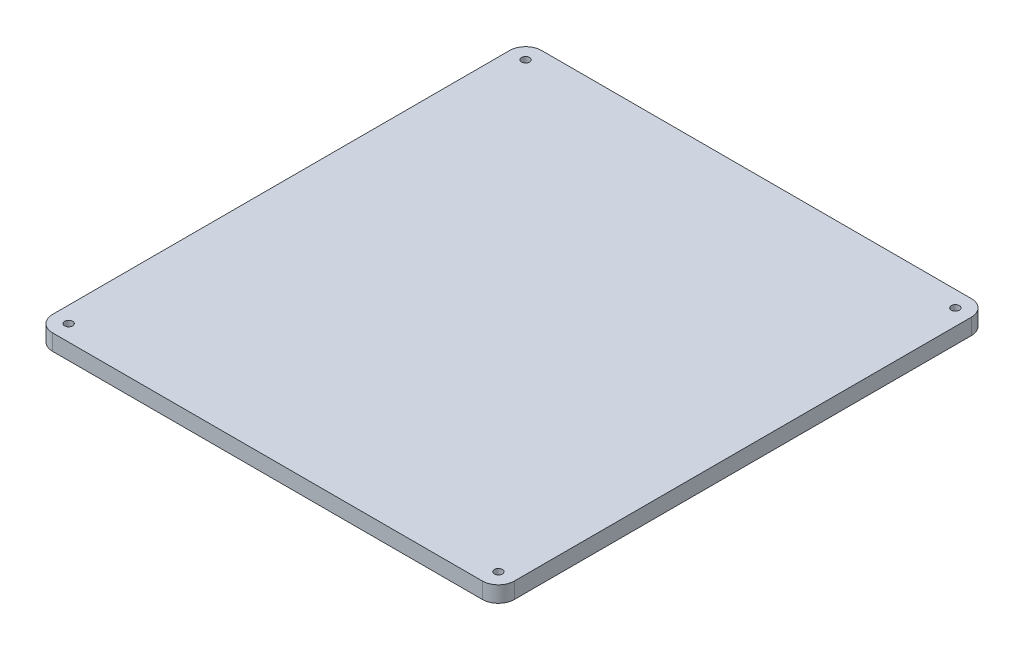
from build123d import *

# Parameters (mm, degrees)
SKETCH1_W           = 288
SKETCH1_H           = 305
SKETCH1_R           = 2.5
BOSS_EXTRUDE1_DEPTH = 10
FILLET1_R           = 10


with BuildPart() as part:
    # Sketch1 → Boss-Extrude1 (new body)
    with BuildSketch(Plane(origin=(0, 0, 0), x_dir=(1, 0, 0), z_dir=(0, 1, 0))):
        with Locations((78.30090957, -95.844317294)):
            Rectangle(SKETCH1_W, SKETCH1_H)
        with Locations(Location((-55.69909043, 46.655682706, 0), (0, 0, 270))):
            Circle(SKETCH1_R, mode=Mode.SUBTRACT)
        with Locations(Location((212.30090957, 46.655682706, 0), (0, 0, 90))):
            Circle(SKETCH1_R, mode=Mode.SUBTRACT)
        with Locations(Location((212.30090957, -238.344317294, 0), (0, 0, 270))):
            Circle(SKETCH1_R, mode=Mode.SUBTRACT)
        with Locations(Location((-55.69909043, -238.344317294, 0), (0, 0, 90))):
            Circle(SKETCH1_R, mode=Mode.SUBTRACT)
    extrude(amount=BOSS_EXTRUDE1_DEPTH)

    # Fillet1
    fillet1_edges = [part.edges().sort_by_distance(p)[0] for p in [
        (-65.69909043, 5, -56.655682706),
        (222.30090957, 5, -56.655682706),
        (222.30090957, 5, 248.344317294),
        (-65.69909043, 5, 248.344317294),
    ]]
    fillet(fillet1_edges, radius=FILLET1_R)


solid = part.part
